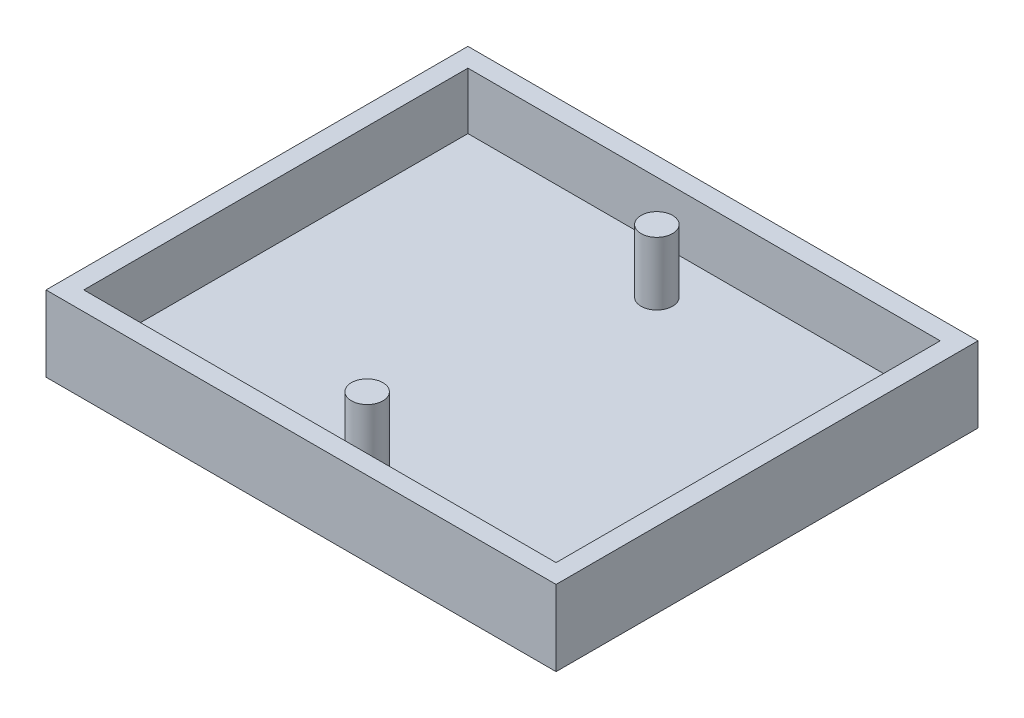
from build123d import *

# Parameters (mm, degrees)
ESQUISSE1_W        = 40.5
ESQUISSE1_H        = 33.5
ESQUISSE1_W_2      = 37.5
ESQUISSE1_H_2      = 30.5
BOSS_EXTRU_1_DEPTH = 4.5
ESQUISSE2_W        = 40.5
ESQUISSE2_H        = 33.5
BOSS_EXTRU_2_DEPTH = 1.5
ESQUISSE3_R        = 1.25
BOSS_EXTRU_3_DEPTH = 5


with BuildPart() as part:
    # Esquisse1 → Boss.-Extru.1 (new body)
    with BuildSketch(Plane(origin=(0, 0, 0), x_dir=(1, 0, 0), z_dir=(0, 1, 0))):
        with Locations((18.75, 15.25)):
            Rectangle(ESQUISSE1_W, ESQUISSE1_H)
        with Locations((18.75, 15.25)):
            Rectangle(ESQUISSE1_W_2, ESQUISSE1_H_2, mode=Mode.SUBTRACT)
    extrude(amount=BOSS_EXTRU_1_DEPTH)

    # Esquisse2 → Boss.-Extru.2 (add)
    with BuildSketch(Plane.XZ):
        with Locations((18.75, -15.25)):
            Rectangle(ESQUISSE2_W, ESQUISSE2_H)
    extrude(amount=BOSS_EXTRU_2_DEPTH)

    # Esquisse3 → Boss.-Extru.3 (add)
    with BuildSketch(Plane(origin=(0, 0, 0), x_dir=(1, 0, 0), z_dir=(0, 1, 0))):
        with Locations(Location((18.75, 26.75, 0), (0, 0, 90))):
            Circle(ESQUISSE3_R)
        with Locations(Location((18.75, 3.75, 0), (0, 0, 90))):
            Circle(ESQUISSE3_R)
    extrude(amount=BOSS_EXTRU_3_DEPTH)


solid = part.part
